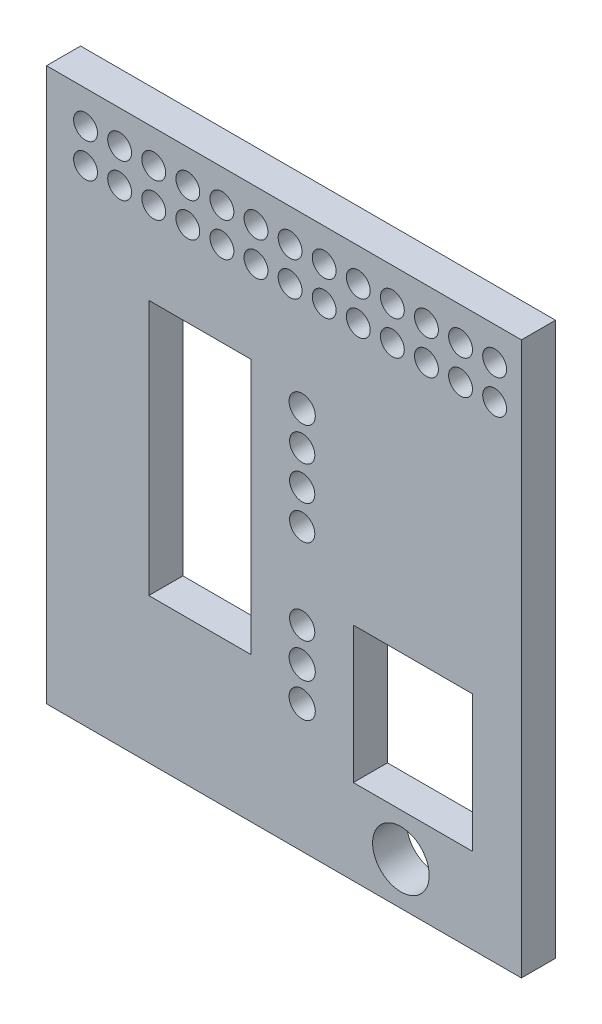
from build123d import *

# Parameters (mm, degrees)
MODEL_W             = 35.3822
MODEL_H             = 41.1734
MODEL_W_2           = 7.62
MODEL_H_2           = 19.05
MODEL_R             = 2.1079968
MODEL_W_3           = 8.89
MODEL_H_3           = 10.16
MODEL_R_2           = 0.97623725
MODEL_R_3           = 0.9398
MODEL_R_4           = 0.889
BOSS_EXTRUDE3_DEPTH = 2.54


with BuildPart() as part:
    # Model → Boss-Extrude3 (new body)
    with BuildSketch(Plane.XY):
        with Locations((17.6911, 20.5867)):
            Rectangle(MODEL_W, MODEL_H)
        with Locations((11.43, 20.32)):
            Rectangle(MODEL_W_2, MODEL_H_2, mode=Mode.SUBTRACT)
        with Locations((26.4033, 3.175)):
            Circle(MODEL_R, mode=Mode.SUBTRACT)
        with Locations((27.305, 11.43)):
            Rectangle(MODEL_W_3, MODEL_H_3, mode=Mode.SUBTRACT)
        with Locations((19.05, 12.065)):
            Circle(MODEL_R_2, mode=Mode.SUBTRACT)
        with Locations((19.05, 14.605)):
            Circle(MODEL_R_3, mode=Mode.SUBTRACT)
        with Locations((19.05, 9.525)):
            Circle(MODEL_R_2, mode=Mode.SUBTRACT)
        with Locations((19.05, 28.575)):
            Circle(MODEL_R_2, mode=Mode.SUBTRACT)
        with Locations((19.05, 20.955)):
            Circle(MODEL_R_3, mode=Mode.SUBTRACT)
        with Locations((19.05, 23.495)):
            Circle(MODEL_R_3, mode=Mode.SUBTRACT)
        with Locations((19.05, 26.035)):
            Circle(MODEL_R_3, mode=Mode.SUBTRACT)
        with Locations((23.2283, 38.7096)):
            Circle(MODEL_R_4, mode=Mode.SUBTRACT)
        with Locations((25.7683, 38.7096)):
            Circle(MODEL_R_4, mode=Mode.SUBTRACT)
        with Locations((28.3083, 36.1696)):
            Circle(MODEL_R_4, mode=Mode.SUBTRACT)
        with Locations((30.8483, 36.1696)):
            Circle(MODEL_R_4, mode=Mode.SUBTRACT)
        with Locations((28.3083, 38.7096)):
            Circle(MODEL_R_4, mode=Mode.SUBTRACT)
        with Locations((30.8483, 38.7096)):
            Circle(MODEL_R_4, mode=Mode.SUBTRACT)
        with Locations((33.3883, 36.1696)):
            Circle(MODEL_R_4, mode=Mode.SUBTRACT)
        with Locations((33.3883, 38.7096)):
            Circle(MODEL_R_4, mode=Mode.SUBTRACT)
        with Locations((2.9083, 36.1696)):
            Circle(MODEL_R_4, mode=Mode.SUBTRACT)
        with Locations((2.9083, 38.7096)):
            Circle(MODEL_R_4, mode=Mode.SUBTRACT)
        with Locations((5.4483, 36.1696)):
            Circle(MODEL_R_4, mode=Mode.SUBTRACT)
        with Locations((7.9883, 36.1696)):
            Circle(MODEL_R_4, mode=Mode.SUBTRACT)
        with Locations((5.4483, 38.7096)):
            Circle(MODEL_R_4, mode=Mode.SUBTRACT)
        with Locations((7.9883, 38.7096)):
            Circle(MODEL_R_4, mode=Mode.SUBTRACT)
        with Locations((10.5283, 36.1696)):
            Circle(MODEL_R_4, mode=Mode.SUBTRACT)
        with Locations((13.0683, 36.1696)):
            Circle(MODEL_R_4, mode=Mode.SUBTRACT)
        with Locations((10.5283, 38.7096)):
            Circle(MODEL_R_4, mode=Mode.SUBTRACT)
        with Locations((13.0683, 38.7096)):
            Circle(MODEL_R_4, mode=Mode.SUBTRACT)
        with Locations((15.6083, 36.1696)):
            Circle(MODEL_R_4, mode=Mode.SUBTRACT)
        with Locations((15.6083, 38.7096)):
            Circle(MODEL_R_4, mode=Mode.SUBTRACT)
        with Locations((18.1483, 36.1696)):
            Circle(MODEL_R_4, mode=Mode.SUBTRACT)
        with Locations((20.6883, 36.1696)):
            Circle(MODEL_R_4, mode=Mode.SUBTRACT)
        with Locations((18.1483, 38.7096)):
            Circle(MODEL_R_4, mode=Mode.SUBTRACT)
        with Locations((20.6883, 38.7096)):
            Circle(MODEL_R_4, mode=Mode.SUBTRACT)
        with Locations((23.2283, 36.1696)):
            Circle(MODEL_R_4, mode=Mode.SUBTRACT)
        with Locations((25.7683, 36.1696)):
            Circle(MODEL_R_4, mode=Mode.SUBTRACT)
    extrude(amount=BOSS_EXTRUDE3_DEPTH)


solid = part.part
